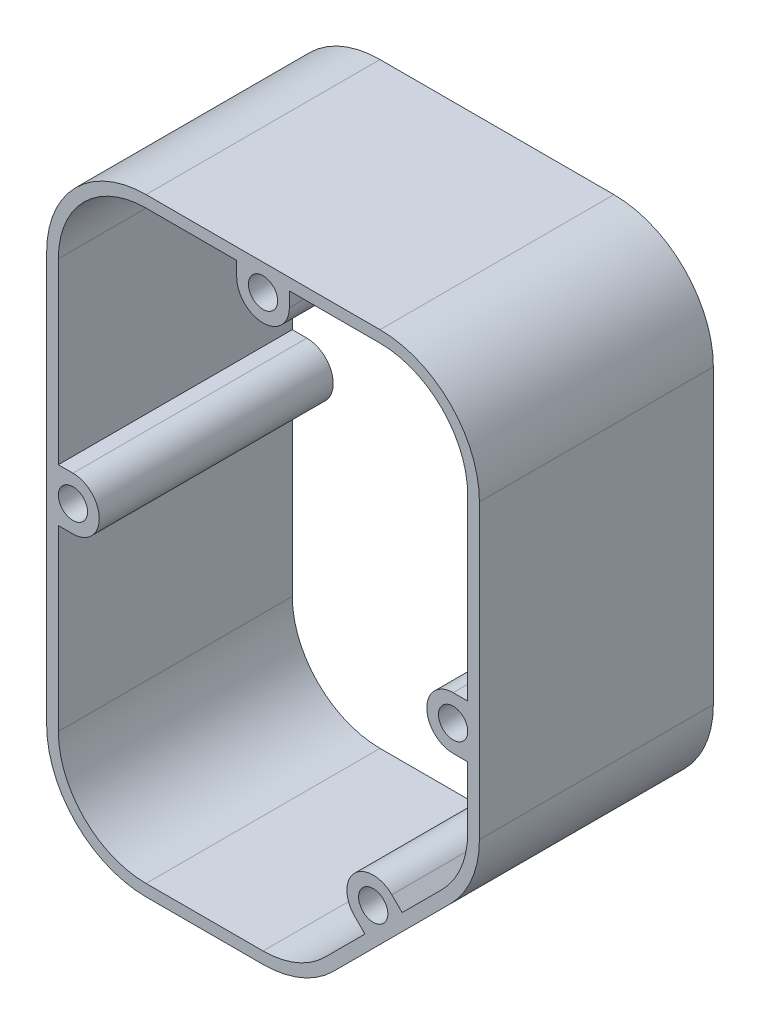
from build123d import *

# Parameters (mm, degrees)
SKETCH1_R           = 1.25
BOSS_EXTRUDE1_DEPTH = 20


with BuildPart() as part:
    # Sketch1 → Boss-Extrude1 (new body)
    with BuildSketch(Plane.XY):
        with BuildLine():
            Line((95.67108193, -66.01040764), (105.67108193, -56.01040764))
            ThreePointArc((105.67108193, -56.01040764), (107.513650317, -53.252809175), (108.16067429, -50))
            Line((108.16067429, -50), (108.16067429, -25))
            ThreePointArc((108.16067429, -25), (105.67108193, -18.98959236), (99.66067429, -16.5))
            Line((99.66067429, -16.5), (79.66067429, -16.5))
            ThreePointArc((79.66067429, -16.5), (73.65026665, -18.98959236), (71.16067429, -25))
            Line((71.16067429, -25), (71.16067429, -60))
            ThreePointArc((71.16067429, -60), (73.65026665, -66.01040764), (79.66067429, -68.5))
            Line((79.66067429, -68.5), (89.66067429, -68.5))
            ThreePointArc((89.66067429, -68.5), (92.913483465, -67.852976026), (95.67108193, -66.01040764))
        make_face()
        with Locations((73.41067429, -42.5)):
            Circle(SKETCH1_R, mode=Mode.SUBTRACT)
        with BuildLine():
            Line((104.963975149, -55.303300859), (101.554965407, -58.712310601))
            Line((101.554965407, -58.712310601), (100.67108193, -57.828427125))
            ThreePointArc((100.67108193, -57.828427125), (97.489101415, -57.828427125), (97.489101415, -61.01040764))
            Line((97.489101415, -61.01040764), (98.372984892, -61.894291117))
            Line((98.372984892, -61.894291117), (94.963975149, -65.303300859))
            ThreePointArc((94.963975149, -65.303300859), (92.530800033, -66.929096494), (89.66067429, -67.5))
            Line((89.66067429, -67.5), (79.66067429, -67.5))
            ThreePointArc((79.66067429, -67.5), (74.357373431, -65.303300859), (72.16067429, -60))
            Line((72.16067429, -60), (72.16067429, -44.75))
            Line((72.16067429, -44.75), (73.41067429, -44.75))
            ThreePointArc((73.41067429, -44.75), (75.66067429, -42.5), (73.41067429, -40.25))
            Line((73.41067429, -40.25), (72.16067429, -40.25))
            Line((72.16067429, -40.25), (72.16067429, -25))
            ThreePointArc((72.16067429, -25), (74.357373431, -19.696699141), (79.66067429, -17.5))
            Line((79.66067429, -17.5), (87.41067429, -17.5))
            Line((87.41067429, -17.5), (87.41067429, -18.75))
            ThreePointArc((87.41067429, -18.75), (89.66067429, -21), (91.91067429, -18.75))
            Line((91.91067429, -18.75), (91.91067429, -17.5))
            Line((91.91067429, -17.5), (99.66067429, -17.5))
            ThreePointArc((99.66067429, -17.5), (104.963975149, -19.696699141), (107.16067429, -25))
            Line((107.16067429, -25), (107.16067429, -40.25))
            Line((107.16067429, -40.25), (105.91067429, -40.25))
            ThreePointArc((105.91067429, -40.25), (103.66067429, -42.5), (105.91067429, -44.75))
            Line((105.91067429, -44.75), (107.16067429, -44.75))
            Line((107.16067429, -44.75), (107.16067429, -50))
            ThreePointArc((107.16067429, -50), (106.589770784, -52.870125743), (104.963975149, -55.303300859))
        make_face(mode=Mode.SUBTRACT)
        with Locations((89.66067429, -18.75)):
            Circle(SKETCH1_R, mode=Mode.SUBTRACT)
        with Locations((105.91067429, -42.5)):
            Circle(SKETCH1_R, mode=Mode.SUBTRACT)
        with Locations((99.080091673, -59.419417382)):
            Circle(SKETCH1_R, mode=Mode.SUBTRACT)
    extrude(amount=BOSS_EXTRUDE1_DEPTH)


solid = part.part
